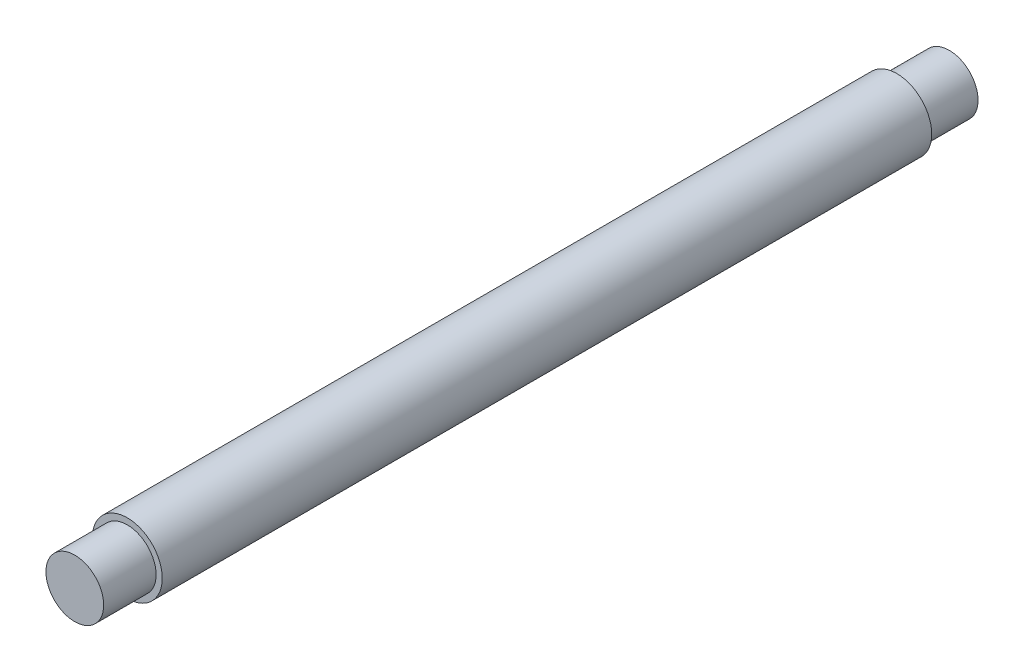
from build123d import *

# Parameters (mm, degrees)
BOSS_EXTRUDE1_DEPTH      = 220
BOSS_EXTRUDE1_DEPTH_BACK = 220
SKETCH2_R                = 20
SKETCH3_R                = 16.5
BOSS_EXTRUDE2_DEPTH      = 30
BOSS_EXTRUDE3_START      = 30
SKETCH4_R                = 16.5
BOSS_EXTRUDE3_DEPTH      = 30


with BuildPart() as part:
    # Sketch2 → Boss-Extrude1 (new, two sides: drawn at the far end of the back side and taken through both)
    with BuildSketch(Plane.XY.offset(-BOSS_EXTRUDE1_DEPTH_BACK)):
        Circle(SKETCH2_R)
    extrude(amount=BOSS_EXTRUDE1_DEPTH + BOSS_EXTRUDE1_DEPTH_BACK)

    # Sketch3 → Boss-Extrude2 (add)
    with BuildSketch(Plane.XY.offset(220)):
        Circle(SKETCH3_R)
    extrude(amount=BOSS_EXTRUDE2_DEPTH)

    # Sketch4 → Boss-Extrude3 (add)
    with BuildSketch(Plane(origin=(0, 0, -220), x_dir=(-1, 0, 0), z_dir=(0, 0, -1)).offset(BOSS_EXTRUDE3_START)):
        Circle(SKETCH4_R)
    extrude(amount=-BOSS_EXTRUDE3_DEPTH)


solid = part.part
